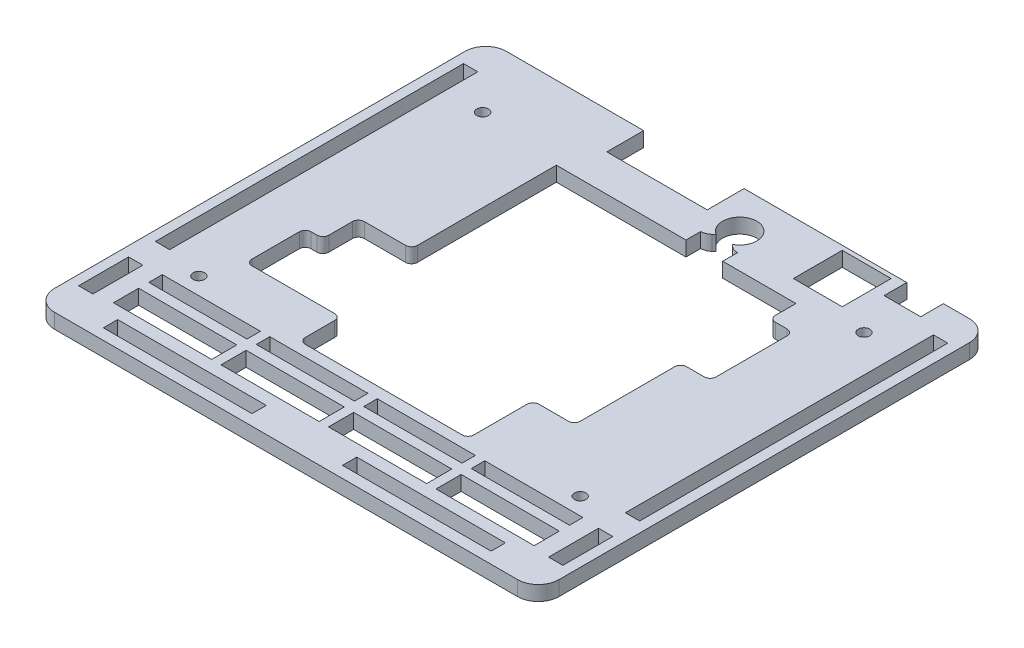
from build123d import *

# Parameters (mm, degrees)
BOSS_EXTRUDE1_DEPTH = 1.5875
SKETCH2_R           = 1.2446
CUT_EXTRUDE1_DEPTH  = 73.874128278
CUT_EXTRUDE2_DEPTH  = 3.175
SKETCH4_W           = 10.5156
SKETCH4_H           = 10.5156
SKETCH4_W_2         = 3.0734
SKETCH4_H_2         = 66.2432
SKETCH4_H_3         = 10.7442
CUT_EXTRUDE3_DEPTH  = 3.175
SKETCH5_W           = 21.1074
SKETCH5_H           = 2.8956
SKETCH5_H_2         = 5.4102
CUT_EXTRUDE4_DEPTH  = 3.175
SKETCH7_W           = 31.9532
SKETCH7_H           = 3.0734
CUT_EXTRUDE5_DEPTH  = 3.175
FILLET1_R           = 4.445
BOSS_EXTRUDE2_DEPTH = 3.175
BOSS_EXTRUDE3_DEPTH = 3.175


with BuildPart() as part:
    # Sketch1 → Boss-Extrude1 (new, symmetric)
    with BuildSketch(Plane(origin=(0, 0, 0), x_dir=(1, 0, 0), z_dir=(0, 1, 0))):
        Polygon((-20.2692, 48.5775), (-20.2692, 40.6527), (1.3208, 40.6527), (1.3208, 48.5775), (36.2966, 48.5775), (36.2966, 43.0657), (37.1348, 43.0657), (37.1348, 38.7223), (47.1424, 38.7223), (47.1424, 42.701382431), (44.1706, 42.701382431), (44.1706, 48.5775), (54.229, 48.5775), (54.229, -48.5775), (-54.229, -48.5775), (-54.229, 48.5775), align=None)
    extrude(amount=BOSS_EXTRUDE1_DEPTH, both=True)

    # Sketch2 → Cut-Extrude1 (cut, through all)
    with BuildSketch(Plane(origin=(0, 1.5875, 0), x_dir=(1, 0, 0), z_dir=(0, 1, 0))):
        with Locations(Location((-40.9956, 34.6837, 0), (0, 0, 270))):
            Circle(SKETCH2_R)
        with Locations(Location((-40.9956, -26.3271, 0), (0, 0, 270))):
            Circle(SKETCH2_R)
        with Locations(Location((40.9956, -26.3271, 0), (0, 0, 90))):
            Circle(SKETCH2_R)
        with Locations(Location((40.9956, 34.6837, 0), (0, 0, 90))):
            Circle(SKETCH2_R)
    extrude(amount=-CUT_EXTRUDE1_DEPTH, mode=Mode.SUBTRACT)

    # Sketch3 → Cut-Extrude2 (cut)
    with BuildSketch(Plane(origin=(0, 1.5875, 0), x_dir=(1, 0, 0), z_dir=(0, 1, 0))):
        with BuildLine():
            Line((-21.9456, 35.9283), (4.650175487, 35.9283))
            ThreePointArc((4.650175487, 35.9283), (5.599614823, 36.112421194), (6.41140699, 36.63809138))
            Line((6.41140699, 36.63809138), (6.842452629, 37.052891721))
            ThreePointArc((6.842452629, 37.052891721), (8.881692758, 43.876586936), (10.477108356, 36.935696088))
            Line((10.477108356, 36.935696088), (10.786368497, 36.63809138))
            ThreePointArc((10.786368497, 36.63809138), (11.598160664, 36.112421194), (12.5476, 35.9283))
            Line((12.5476, 35.9283), (27.0256, 35.9283))
            ThreePointArc((27.0256, 35.9283), (27.923625612, 35.556325612), (28.2956, 34.6583))
            Line((28.2956, 34.6583), (28.2956, 28.3337))
            ThreePointArc((28.2956, 28.3337), (28.667574388, 27.435674388), (29.5656, 27.0637))
            Line((29.5656, 27.0637), (32.1056, 27.0637))
            ThreePointArc((32.1056, 27.0637), (33.003625612, 26.691725612), (33.3756, 25.7937))
            Line((33.3756, 25.7937), (33.3756, 10.5029))
            ThreePointArc((33.3756, 10.5029), (33.003625612, 9.604874388), (32.1056, 9.2329))
            Line((32.1056, 9.2329), (28.2956, 9.2329))
            ThreePointArc((28.2956, 9.2329), (27.397574388, 8.860925612), (27.0256, 7.9629))
            Line((27.0256, 7.9629), (27.0256, -12.3571))
            ThreePointArc((27.0256, -12.3571), (26.653625612, -13.255125612), (25.7556, -13.6271))
            Line((25.7556, -13.6271), (19.4056, -13.6271))
            ThreePointArc((19.4056, -13.6271), (18.507574388, -13.999074388), (18.1356, -14.8971))
            Line((18.1356, -14.8971), (18.1356, -26.3271))
            ThreePointArc((18.1356, -26.3271), (17.763625612, -27.225125612), (16.8656, -27.5971))
            Line((16.8656, -27.5971), (-16.8656, -27.5971))
            ThreePointArc((-16.8656, -27.5971), (-17.763625612, -27.225125612), (-18.1356, -26.3271))
            Line((-18.1356, -26.3271), (-18.1356, -19.9771))
            ThreePointArc((-18.1356, -19.9771), (-18.507574388, -19.079074388), (-19.4056, -18.7071))
            Line((-19.4056, -18.7071), (-37.1856, -18.7071))
            ThreePointArc((-37.1856, -18.7071), (-38.083625612, -18.335125612), (-38.4556, -17.4371))
            Line((-38.4556, -17.4371), (-38.4556, -7.2771))
            ThreePointArc((-38.4556, -7.2771), (-38.083625612, -6.379074388), (-37.1856, -6.0071))
            Line((-37.1856, -6.0071), (-35.9156, -6.0071))
            ThreePointArc((-35.9156, -6.0071), (-35.017574388, -5.635125612), (-34.6456, -4.7371))
            Line((-34.6456, -4.7371), (-34.6456, 0.3429))
            ThreePointArc((-34.6456, 0.3429), (-34.273625612, 1.240925612), (-33.3756, 1.6129))
            Line((-33.3756, 1.6129), (-24.4856, 1.6129))
            ThreePointArc((-24.4856, 1.6129), (-23.587574388, 1.984874388), (-23.2156, 2.8829))
            Line((-23.2156, 2.8829), (-23.2156, 34.6583))
            ThreePointArc((-23.2156, 34.6583), (-22.843625612, 35.556325612), (-21.9456, 35.9283))
        make_face()
    extrude(amount=-CUT_EXTRUDE2_DEPTH, mode=Mode.SUBTRACT)

    # Sketch4 → Cut-Extrude3 (cut)
    with BuildSketch(Plane(origin=(0, 1.5875, 0), x_dir=(1, 0, 0), z_dir=(0, 1, 0))):
        with Locations((28.6258, 42.3799)):
            Rectangle(SKETCH4_W, SKETCH4_H)
        with Locations((-50.5841, 8.5725)):
            Rectangle(SKETCH4_W_2, SKETCH4_H_2)
        with Locations((-50.5841, -35.687)):
            Rectangle(SKETCH4_W_2, SKETCH4_H_3)
        with Locations((50.4571, 8.5725)):
            Rectangle(SKETCH4_W_2, SKETCH4_H_2)
        with Locations((50.4571, -35.687)):
            Rectangle(SKETCH4_W_2, SKETCH4_H_3)
    extrude(amount=-CUT_EXTRUDE3_DEPTH, mode=Mode.SUBTRACT)

    # Sketch5 → Cut-Extrude4 (cut)
    with BuildSketch(Plane(origin=(0, 1.5875, 0), x_dir=(1, 0, 0), z_dir=(0, 1, 0))):
        with Locations((-34.6583, -31.4325)):
            Rectangle(SKETCH5_W, SKETCH5_H)
        with Locations((-34.6583, -37.7698)):
            Rectangle(SKETCH5_W, SKETCH5_H_2)
        with Locations((-11.5443, -37.7698)):
            Rectangle(SKETCH5_W, SKETCH5_H_2)
        with Locations((-11.5443, -31.4325)):
            Rectangle(SKETCH5_W, SKETCH5_H)
        with Locations((11.5697, -31.4325)):
            Rectangle(SKETCH5_W, SKETCH5_H)
        with Locations((11.5697, -37.7698)):
            Rectangle(SKETCH5_W, SKETCH5_H_2)
        with Locations((34.6837, -37.7698)):
            Rectangle(SKETCH5_W, SKETCH5_H_2)
        with Locations((34.6837, -31.4325)):
            Rectangle(SKETCH5_W, SKETCH5_H)
    extrude(amount=-CUT_EXTRUDE4_DEPTH, mode=Mode.SUBTRACT)

    # Sketch7 → Cut-Extrude5 (cut)
    with BuildSketch(Plane(origin=(0, 1.5875, 0), x_dir=(1, 0, 0), z_dir=(0, 1, 0))):
        with Locations((-25.654, -44.691406541)):
            Rectangle(SKETCH7_W, SKETCH7_H)
        with Locations((25.654, -44.590951919)):
            Rectangle(SKETCH7_W, SKETCH7_H)
    extrude(amount=-CUT_EXTRUDE5_DEPTH, mode=Mode.SUBTRACT)

    # Fillet1
    fillet1_edges = [part.edges().sort_by_distance(p)[0] for p in [
        (-54.229, 0, -48.5775),
        (54.229, 0, -48.5775),
        (54.229, 0, 48.5775),
        (-54.229, 0, 48.5775),
    ]]
    fillet(fillet1_edges, radius=FILLET1_R)

    # Sketch8 → Boss-Extrude2 (add)
    with BuildSketch(Plane(origin=(0, 1.5875, 0), x_dir=(1, 0, 0), z_dir=(0, 1, 0))):
        Polygon((37.1348, 43.0657), (37.1348, 38.7223), (47.1424, 38.7223), (47.1424, 43.0657), (47.1424, 43.7007), (36.2966, 43.7007), (36.2966, 43.0657), align=None)
    extrude(amount=-BOSS_EXTRUDE2_DEPTH)

    # Sketch9 → Boss-Extrude3 (add)
    with BuildSketch(Plane(origin=(0, 1.5875, 0), x_dir=(1, 0, 0), z_dir=(0, 1, 0))):
        Polygon((-23.2156, 34.6583), (-23.2156, 35.9283), (4.650175487, 35.9283), (4.650175487, 32.7533), (-23.2156, 32.7533), align=None)
        Polygon((28.2956, 34.6583), (28.2956, 35.9283), (12.5476, 35.9283), (12.5476, 32.7533), (28.2956, 32.7533), align=None)
    extrude(amount=-BOSS_EXTRUDE3_DEPTH)


solid = part.part
